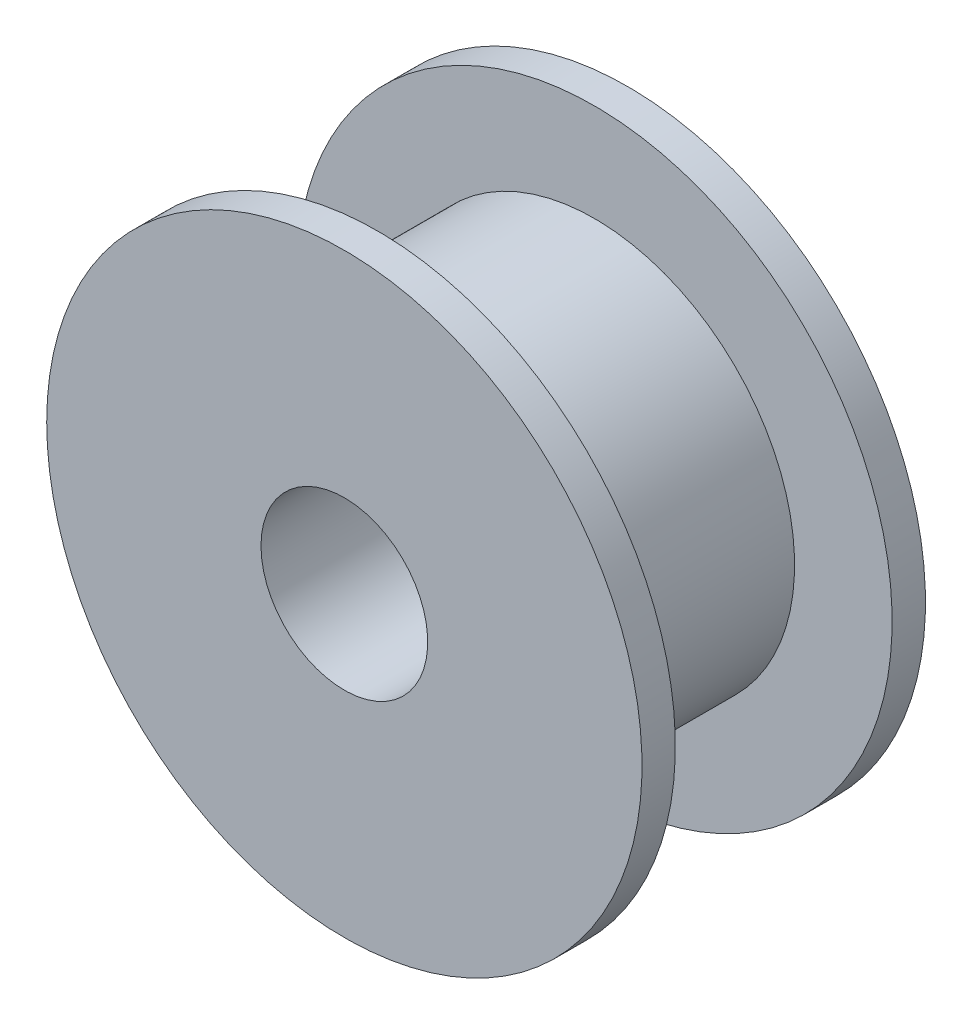
from build123d import *

# Parameters (mm, degrees)
SKETCH6_R           = 6
BOSS_EXTRUDE1_DEPTH = 3.25
SKETCH8_R           = 8.925
BOSS_EXTRUDE2_DEPTH = 1
SKETCH9_R           = 2.5
CUT_EXTRUDE1_DEPTH  = 14.318173674


with BuildPart() as part:
    # Sketch6 → Boss-Extrude1 (new body)
    with BuildSketch(Plane.XY):
        with Locations(Location((0, 0, 0), (0, 0, 180))):
            Circle(SKETCH6_R)
    boss_extrude1 = extrude(amount=BOSS_EXTRUDE1_DEPTH)

    # Sketch8 → Boss-Extrude2 (add)
    with BuildSketch(Plane(origin=(0, 0, 0), x_dir=(-1, 0, 0), z_dir=(0, 0, -1))):
        Circle(SKETCH8_R)
    boss_extrude2 = extrude(amount=BOSS_EXTRUDE2_DEPTH)

    # Sketch9 → Cut-Extrude1 (cut, through all)
    with BuildSketch(Plane(origin=(0, 0, -1), x_dir=(-1, 0, 0), z_dir=(0, 0, -1))):
        Circle(SKETCH9_R)
    cut_extrude1 = extrude(amount=-CUT_EXTRUDE1_DEPTH, mode=Mode.SUBTRACT)

    # Mirror2: Boss-Extrude1, Boss-Extrude2, Cut-Extrude1 across plane
    add(boss_extrude1.mirror(Plane.XY.offset(3.25)))
    add(boss_extrude2.mirror(Plane.XY.offset(3.25)))
    add(cut_extrude1.mirror(Plane.XY.offset(3.25)), mode=Mode.SUBTRACT)


solid = part.part
